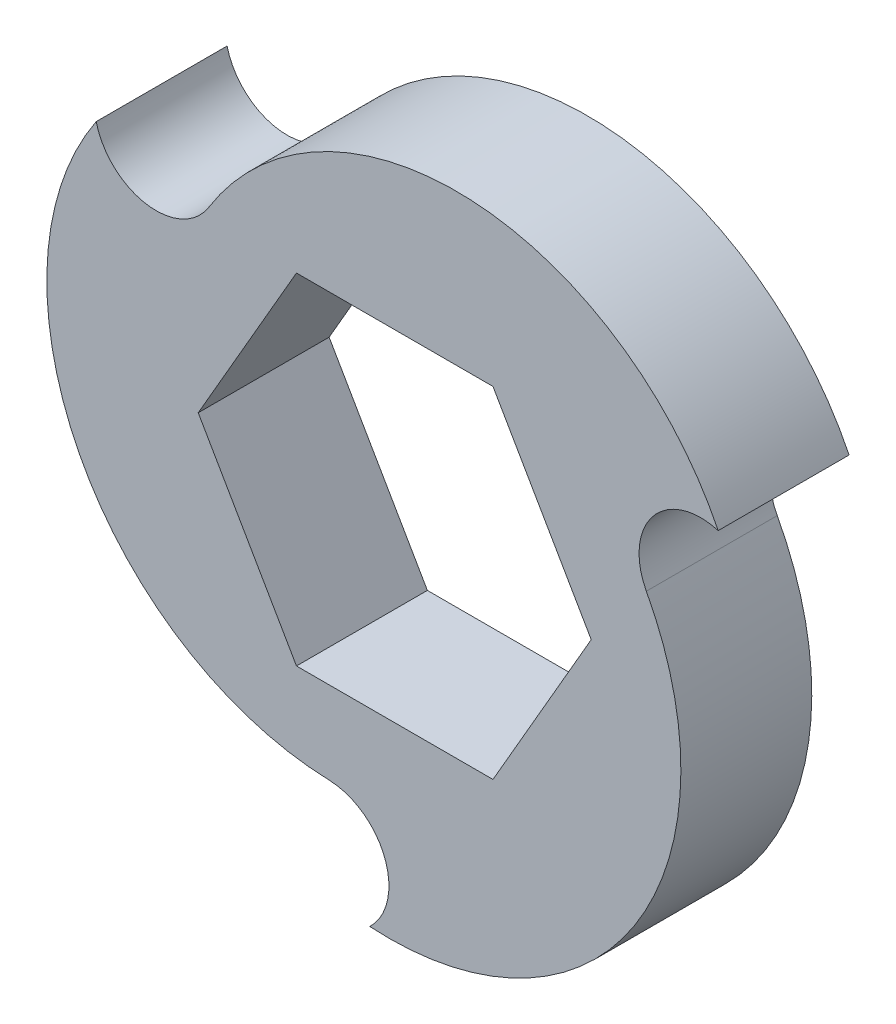
from build123d import *

# Parameters (mm, degrees)
BOSS_EXTRUDE1_DEPTH = 5


with BuildPart() as part:
    # Sketch1 → Boss-Extrude1 (new body)
    with BuildSketch(Plane.XY):
        with BuildLine():
            ThreePointArc((-7.106112246, 6.995417074), (2.908276026, 12.245932527), (12.355783111, 6.033002876))
            ThreePointArc((12.355783111, 6.033002876), (9.860301204, 5.257635244), (9.611265019, 2.65636519))
            ThreePointArc((9.611265019, 2.65636519), (9.151150649, -8.641607183), (-0.953157804, -13.716923496))
            ThreePointArc((-0.953157804, -13.716923496), (-0.376904917, -11.168088953), (-2.505152773, -9.651782264))
            ThreePointArc((-2.505152773, -9.651782264), (-12.059426674, -3.604325344), (-11.402625308, 7.68392062))
            ThreePointArc((-11.402625308, 7.68392062), (-9.483396287, 5.910453709), (-7.106112246, 6.995417074))
        make_face()
        Polygon((7.505553499, 0), (3.75277675, 6.5), (-3.75277675, 6.5), (-7.505553499, 0), (-3.75277675, -6.5), (3.75277675, -6.5), align=None, mode=Mode.SUBTRACT)
    extrude(amount=BOSS_EXTRUDE1_DEPTH)


solid = part.part
